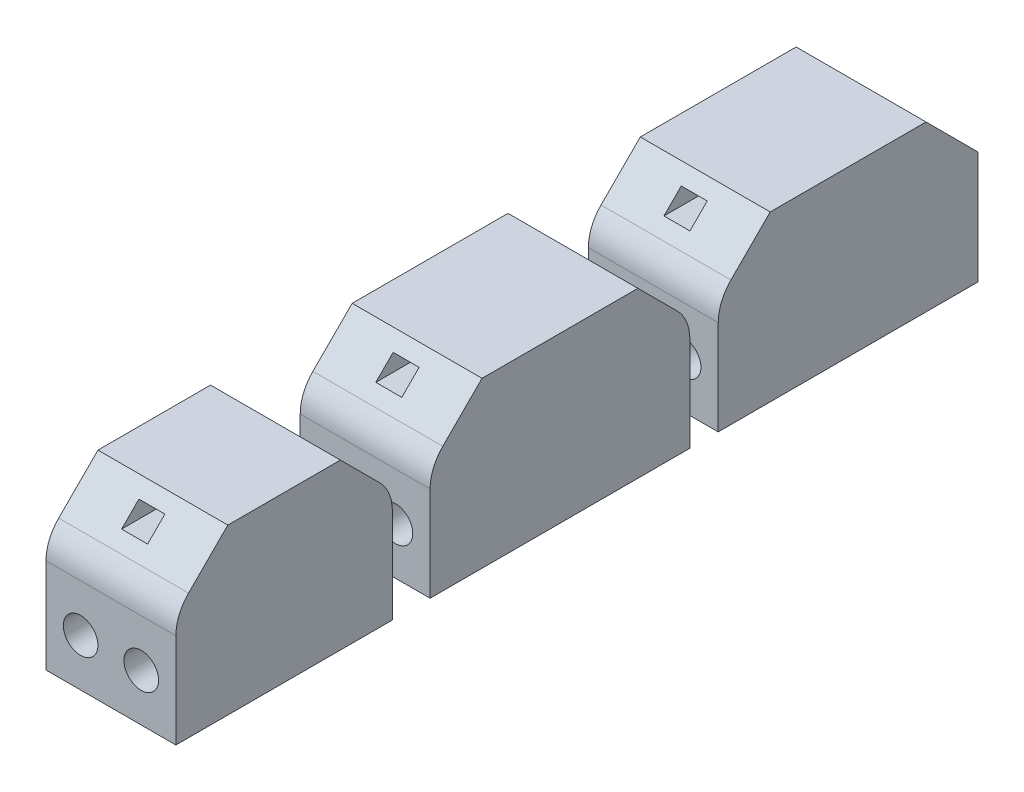
from build123d import *

# Parameters (mm, degrees)
BOSS_EXTRUDE1_DEPTH = 7.5
BOSS_EXTRUDE2_DEPTH = 7.5
BOSS_EXTRUDE3_DEPTH = 7.5
FILLET1_R           = 5
FILLET2_R           = 5
FILLET3_R           = 5
SKETCH4_R           = 2
SKETCH4_W           = 3
SKETCH4_H           = 2
CUT_EXTRUDE1_DEPTH  = 100


with BuildPart() as part:
    # Sketch1 → Boss-Extrude1 (new, symmetric)
    with BuildSketch(Plane(origin=(0, 0, 0), x_dir=(0, 0, -1), z_dir=(1, 0, 0))):
        Polygon((-31.324369962, -10.21673477), (-37.324369962, -16.21673477), (-37.324369962, -29.21673477), (-12.324369962, -29.21673477), (-12.324369962, -16.21673477), (-18.324369962, -10.21673477), align=None)
    extrude(amount=BOSS_EXTRUDE1_DEPTH, both=True)

    # Fillet3
    fillet3_edges = [part.edges().sort_by_distance(p)[0] for p in [
        (0, -16.21673477, 12.324369962),
        (0, -16.21673477, 37.324369962),
    ]]
    fillet(fillet3_edges, radius=FILLET3_R)


with BuildPart() as body_2:
    # Sketch2 → Boss-Extrude2 (new, symmetric)
    with BuildSketch(Plane(origin=(0, 0, 0), x_dir=(0, 0, -1), z_dir=(1, 0, 0))):
        Polygon((-7.967160281, -29.21673477), (-7.967160281, -16.21673477), (-1.967160281, -10.21673477), (16.032839719, -10.21673477), (22.032839719, -16.21673477), (22.032839719, -29.21673477), align=None)
    extrude(amount=BOSS_EXTRUDE2_DEPTH, both=True)

    # Fillet2
    fillet2_edges = [body_2.edges().sort_by_distance(p)[0] for p in [
        (0, -16.21673477, 7.967160281),
        (0, -16.21673477, -22.032839719),
    ]]
    fillet(fillet2_edges, radius=FILLET2_R)


with BuildPart() as body_3:
    # Sketch3 → Boss-Extrude3 (new, symmetric)
    with BuildSketch(Plane(origin=(0, 0, 0), x_dir=(0, 0, -1), z_dir=(1, 0, 0))):
        Polygon((25.31118522, -16.21673477), (25.31118522, -29.21673477), (55.31118522, -29.21673477), (55.31118522, -16.21673477), (49.31118522, -10.21673477), (31.31118522, -10.21673477), align=None)
    extrude(amount=BOSS_EXTRUDE3_DEPTH, both=True)

    # Fillet1
    fillet1_edges = [body_3.edges().sort_by_distance(p)[0] for p in [
        (0, -16.21673477, -25.31118522),
    ]]
    fillet(fillet1_edges, radius=FILLET1_R)


with BuildPart() as cut_extrude1_tool:
    # Sketch4 → Cut-Extrude1 (new, symmetric)
    with BuildSketch(Plane.XY):
        with Locations((-3.5, -23.752268676)):
            Circle(SKETCH4_R)
        with Locations((3.5, -23.752268676)):
            Circle(SKETCH4_R)
        with Locations((0, -12.484501723)):
            Rectangle(SKETCH4_W, SKETCH4_H)
    extrude(amount=CUT_EXTRUDE1_DEPTH, both=True)


with BuildPart() as part_1:
    add(part.part)

    # Cut-Extrude1: cut by cut_extrude1_tool
    add(cut_extrude1_tool.part, mode=Mode.SUBTRACT)


with BuildPart() as body_2_1:
    add(body_2.part)

    # Cut-Extrude1: cut by cut_extrude1_tool
    add(cut_extrude1_tool.part, mode=Mode.SUBTRACT)


with BuildPart() as body_3_1:
    add(body_3.part)

    # Cut-Extrude1: cut by cut_extrude1_tool
    add(cut_extrude1_tool.part, mode=Mode.SUBTRACT)


solid = Compound([part_1.part, body_2_1.part, body_3_1.part])
